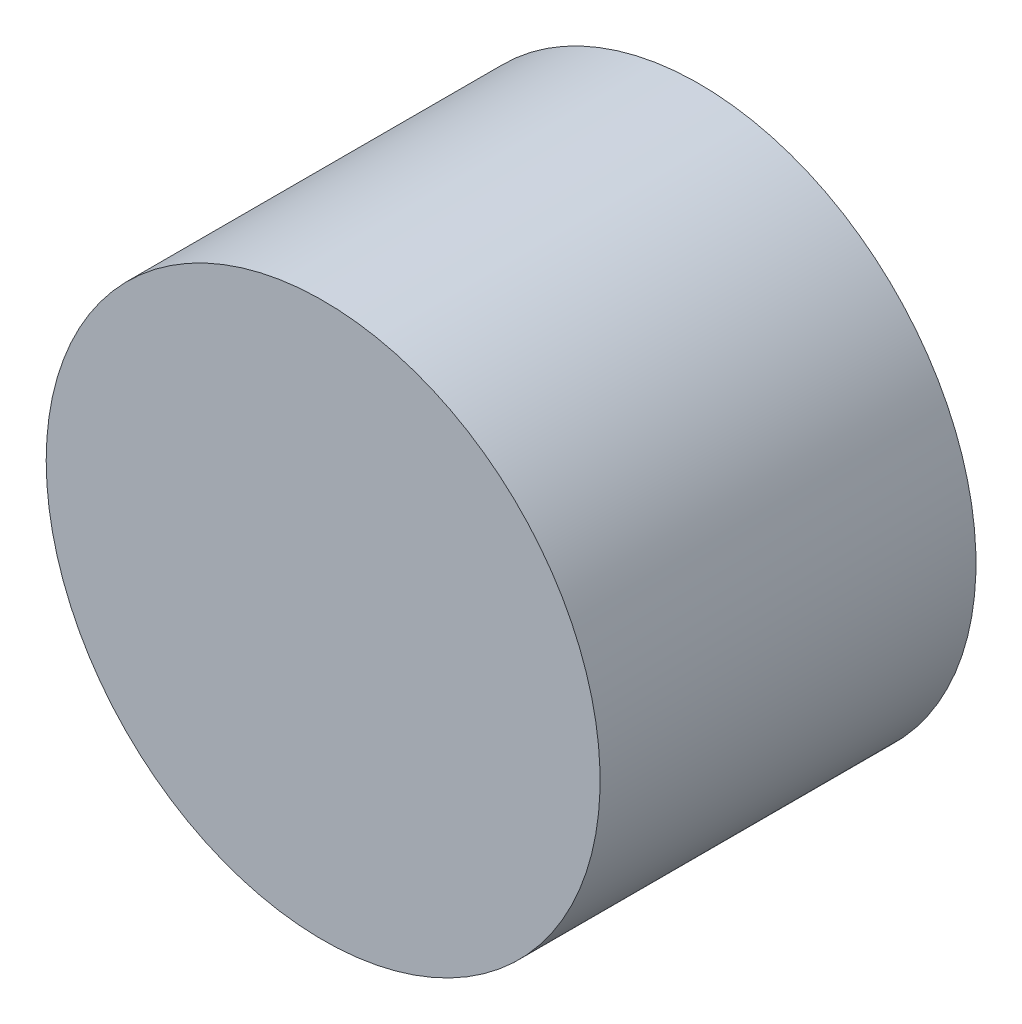
from build123d import *

# Parameters (mm, degrees)
SKETCH_1_R      = 2.8
EXTRUDE_1_DEPTH = 3.8


with BuildPart() as part:
    # Эскиз1 → Бобышка-Вытянуть1 (new body)
    with BuildSketch(Plane.XY):
        with Locations(Location((0, 0, 0), (0, 0, 180))):
            Circle(SKETCH_1_R)
    extrude(amount=EXTRUDE_1_DEPTH)


solid = part.part
